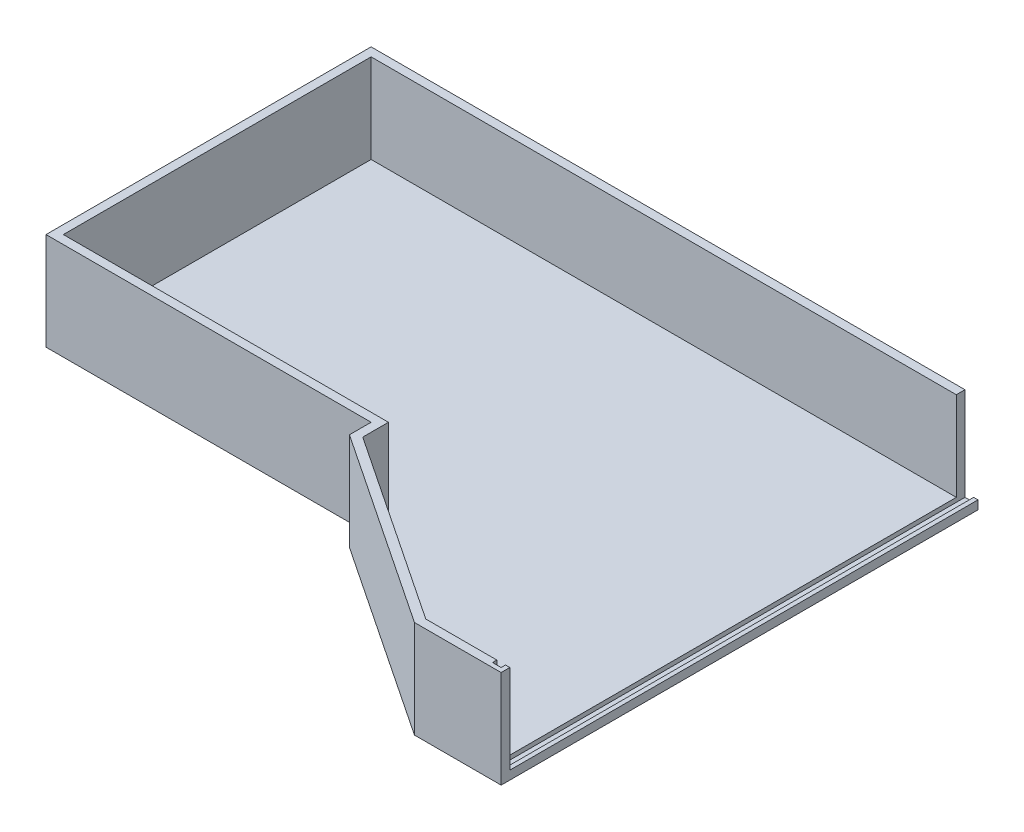
from build123d import *

# Parameters (mm, degrees)
BOSS_EXTRUDE1_DEPTH = 22.5
CUT_EXTRUDE1_DEPTH  = 20.5
SKETCH3_W           = 106
SKETCH3_H           = 20.5
CUT_EXTRUDE2_DEPTH  = 20
SKETCH4_W           = 3
SKETCH4_H           = 20.5
CUT_EXTRUDE3_DEPTH  = 20
SKETCH5_W           = 2
SKETCH5_H           = 20.5
CUT_EXTRUDE4_DEPTH  = 1
SKETCH7_W           = 2
SKETCH7_H           = 109
CUT_EXTRUDE6_DEPTH  = 1


with BuildPart() as part:
    # Base → Boss-Extrude1 (new body)
    with BuildSketch(Plane(origin=(0, 0, 0), x_dir=(1, 0, 0), z_dir=(0, 1, 0))):
        Polygon((0, 0), (140, 0), (140, -110), (120, -110), (75, -80), (75, -75), (0, -75), align=None)
    extrude(amount=BOSS_EXTRUDE1_DEPTH)

    # Sketch2 → Cut-Extrude1 (cut)
    with BuildSketch(Plane(origin=(0, 22.5, 0), x_dir=(1, 0, 0), z_dir=(0, 1, 0))):
        Polygon((2, -2), (2, -73), (77, -73), (77, -78.929632483), (120.605551275, -108), (138, -108), (138, -2), align=None)
    extrude(amount=-CUT_EXTRUDE1_DEPTH, mode=Mode.SUBTRACT)

    # Sketch3 → Cut-Extrude2 (cut)
    with BuildSketch(Plane.ZY.offset(-138)):
        with Locations((55, 12.25)):
            Rectangle(SKETCH3_W, SKETCH3_H)
    extrude(amount=-CUT_EXTRUDE2_DEPTH, mode=Mode.SUBTRACT)

    # Sketch4 → Cut-Extrude3 (cut)
    with BuildSketch(Plane.XY.offset(2)):
        with Locations((138.5, 12.25)):
            Rectangle(SKETCH4_W, SKETCH4_H)
    extrude(amount=-CUT_EXTRUDE3_DEPTH, mode=Mode.SUBTRACT)

    # Sketch5 → Cut-Extrude4 (cut)
    with BuildSketch(Plane(origin=(0, 0, 108), x_dir=(-1, 0, 0), z_dir=(0, 0, -1))):
        with Locations((-138, 12.25)):
            Rectangle(SKETCH5_W, SKETCH5_H)
    extrude(amount=-CUT_EXTRUDE4_DEPTH, mode=Mode.SUBTRACT)

    # Sketch7 → Cut-Extrude6 (cut)
    with BuildSketch(Plane(origin=(0, 2, 0), x_dir=(1, 0, 0), z_dir=(0, 1, 0))):
        with Locations((138, -54.5)):
            Rectangle(SKETCH7_W, SKETCH7_H)
    extrude(amount=-CUT_EXTRUDE6_DEPTH, mode=Mode.SUBTRACT)


solid = part.part
